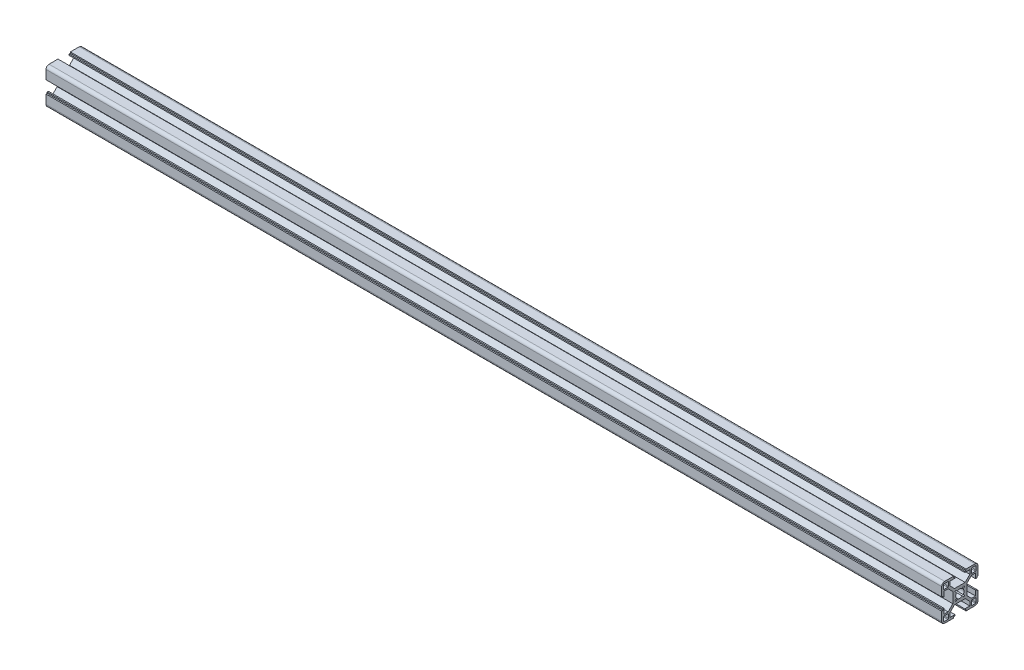
from build123d import *

# Parameters (mm, degrees)
EXTRUDE_1_DEPTH = 50
EXTRUDE_2_DEPTH = 740


with BuildPart() as part:
    # 草图1 → 凸台-拉伸1 (new body)
    with BuildSketch(Plane(origin=(0, 0, 0), x_dir=(0, 0, -1), z_dir=(1, 0, 0))):
        with BuildLine():
            Line((-5.14957074, -13.70467014), (-4.14957074, -13.70467014))
            Line((-4.14957074, -13.70467014), (-4.14957074, -12.70467014))
            Line((-4.14957074, -12.70467014), (-8.29957074, -12.70467014))
            Line((-8.29957074, -12.70467014), (-8.29957074, -9.3688837))
            Line((-8.29957074, -9.3688837), (-4.43535718, -5.50467014))
            Line((-4.43535718, -5.50467014), (4.3362157, -5.50467014))
            Line((4.3362157, -5.50467014), (8.20042926, -9.3688837))
            Line((8.20042926, -9.3688837), (8.20042926, -12.70467014))
            Line((8.20042926, -12.70467014), (4.05042926, -12.70467014))
            Line((4.05042926, -12.70467014), (4.05042926, -13.70467014))
            Line((4.05042926, -13.70467014), (5.05042926, -13.70467014))
            Line((5.05042926, -13.70467014), (5.05042926, -14.70467014))
            Line((5.05042926, -14.70467014), (12.45042926, -14.70467014))
            ThreePointArc((12.45042926, -14.70467014), (14.218196213, -13.972437093), (14.95042926, -12.20467014))
            Line((14.95042926, -12.20467014), (14.95042926, -4.80467014))
            Line((14.95042926, -4.80467014), (13.95042926, -4.80467014))
            Line((13.95042926, -4.80467014), (13.95042926, -3.80467014))
            Line((13.95042926, -3.80467014), (12.95042926, -3.80467014))
            Line((12.95042926, -3.80467014), (12.95042926, -7.95467014))
            Line((12.95042926, -7.95467014), (9.61464282, -7.95467014))
            Line((9.61464282, -7.95467014), (5.75042926, -4.09045658))
            Line((5.75042926, -4.09045658), (5.75042926, 4.6811163))
            Line((5.75042926, 4.6811163), (9.61464282, 8.54532986))
            Line((9.61464282, 8.54532986), (12.95042926, 8.54532986))
            Line((12.95042926, 8.54532986), (12.95042926, 4.39532986))
            Line((12.95042926, 4.39532986), (13.95042926, 4.39532986))
            Line((13.95042926, 4.39532986), (13.95042926, 5.39532986))
            Line((13.95042926, 5.39532986), (14.95042926, 5.39532986))
            Line((14.95042926, 5.39532986), (14.95042926, 12.79532986))
            ThreePointArc((14.95042926, 12.79532986), (14.218196213, 14.563096813), (12.45042926, 15.29532986))
            Line((12.45042926, 15.29532986), (5.05042926, 15.29532986))
            Line((5.05042926, 15.29532986), (5.05042926, 14.29532986))
            Line((5.05042926, 14.29532986), (4.05042926, 14.29532986))
            Line((4.05042926, 14.29532986), (4.05042926, 13.29532986))
            Line((4.05042926, 13.29532986), (8.20042926, 13.29532986))
            Line((8.20042926, 13.29532986), (8.20042926, 9.95954342))
            Line((8.20042926, 9.95954342), (4.3362157, 6.09532986))
            Line((4.3362157, 6.09532986), (-4.43535718, 6.09532986))
            Line((-4.43535718, 6.09532986), (-8.29957074, 9.95954342))
            Line((-8.29957074, 9.95954342), (-8.29957074, 13.29532986))
            Line((-8.29957074, 13.29532986), (-4.14957074, 13.29532986))
            Line((-4.14957074, 13.29532986), (-4.14957074, 14.29532986))
            Line((-4.14957074, 14.29532986), (-5.14957074, 14.29532986))
            Line((-5.14957074, 14.29532986), (-5.14957074, 15.29532986))
            Line((-5.14957074, 15.29532986), (-12.54957074, 15.29532986))
            ThreePointArc((-12.54957074, 15.29532986), (-14.317337693, 14.563096813), (-15.04957074, 12.79532986))
            Line((-15.04957074, 12.79532986), (-15.04957074, 5.39532986))
            Line((-15.04957074, 5.39532986), (-14.04957074, 5.39532986))
            Line((-14.04957074, 5.39532986), (-14.04957074, 4.39532986))
            Line((-14.04957074, 4.39532986), (-13.04957074, 4.39532986))
            Line((-13.04957074, 4.39532986), (-13.04957074, 8.54532986))
            Line((-13.04957074, 8.54532986), (-9.7137843, 8.54532986))
            Line((-9.7137843, 8.54532986), (-5.84957074, 4.6811163))
            Line((-5.84957074, 4.6811163), (-5.84957074, -4.09045658))
            Line((-5.84957074, -4.09045658), (-9.7137843, -7.95467014))
            Line((-9.7137843, -7.95467014), (-13.04957074, -7.95467014))
            Line((-13.04957074, -7.95467014), (-13.04957074, -3.80467014))
            Line((-13.04957074, -3.80467014), (-14.04957074, -3.80467014))
            Line((-14.04957074, -3.80467014), (-14.04957074, -4.80467014))
            Line((-14.04957074, -4.80467014), (-15.04957074, -4.80467014))
            Line((-15.04957074, -4.80467014), (-15.04957074, -12.20467014))
            ThreePointArc((-15.04957074, -12.20467014), (-14.317337693, -13.972437093), (-12.54957074, -14.70467014))
            Line((-12.54957074, -14.70467014), (-5.14957074, -14.70467014))
            Line((-5.14957074, -14.70467014), (-5.14957074, -13.70467014))
        make_face()
        with BuildLine():
            Line((-10.04957074, 9.79532986), (-13.04957074, 9.79532986))
            ThreePointArc((-13.04957074, 9.79532986), (-13.403124131, 9.941776469), (-13.54957074, 10.29532986))
            Line((-13.54957074, 10.29532986), (-13.54957074, 13.29532986))
            ThreePointArc((-13.54957074, 13.29532986), (-13.403124131, 13.648883251), (-13.04957074, 13.79532986))
            Line((-13.04957074, 13.79532986), (-10.04957074, 13.79532986))
            ThreePointArc((-10.04957074, 13.79532986), (-9.696017349, 13.648883251), (-9.54957074, 13.29532986))
            Line((-9.54957074, 13.29532986), (-9.54957074, 10.29532986))
            ThreePointArc((-9.54957074, 10.29532986), (-9.696017349, 9.941776469), (-10.04957074, 9.79532986))
        make_face(mode=Mode.SUBTRACT)
        with BuildLine():
            Line((-10.04957074, -13.20467014), (-13.04957074, -13.20467014))
            ThreePointArc((-13.04957074, -13.20467014), (-13.403124131, -13.058223531), (-13.54957074, -12.70467014))
            Line((-13.54957074, -12.70467014), (-13.54957074, -9.70467014))
            ThreePointArc((-13.54957074, -9.70467014), (-13.403124131, -9.351116749), (-13.04957074, -9.20467014))
            Line((-13.04957074, -9.20467014), (-10.04957074, -9.20467014))
            ThreePointArc((-10.04957074, -9.20467014), (-9.696017349, -9.351116749), (-9.54957074, -9.70467014))
            Line((-9.54957074, -9.70467014), (-9.54957074, -12.70467014))
            ThreePointArc((-9.54957074, -12.70467014), (-9.696017349, -13.058223531), (-10.04957074, -13.20467014))
        make_face(mode=Mode.SUBTRACT)
        with BuildLine():
            Line((12.95042926, 9.79532986), (9.95042926, 9.79532986))
            ThreePointArc((9.95042926, 9.79532986), (9.596875869, 9.941776469), (9.45042926, 10.29532986))
            Line((9.45042926, 10.29532986), (9.45042926, 13.29532986))
            ThreePointArc((9.45042926, 13.29532986), (9.596875869, 13.648883251), (9.95042926, 13.79532986))
            Line((9.95042926, 13.79532986), (12.95042926, 13.79532986))
            ThreePointArc((12.95042926, 13.79532986), (13.303982651, 13.648883251), (13.45042926, 13.29532986))
            Line((13.45042926, 13.29532986), (13.45042926, 10.29532986))
            ThreePointArc((13.45042926, 10.29532986), (13.303982651, 9.941776469), (12.95042926, 9.79532986))
        make_face(mode=Mode.SUBTRACT)
        with BuildLine():
            Line((13.45042926, -9.70467014), (13.45042926, -12.70467014))
            ThreePointArc((13.45042926, -12.70467014), (13.303982651, -13.058223531), (12.95042926, -13.20467014))
            Line((12.95042926, -13.20467014), (9.95042926, -13.20467014))
            ThreePointArc((9.95042926, -13.20467014), (9.596875869, -13.058223531), (9.45042926, -12.70467014))
            Line((9.45042926, -12.70467014), (9.45042926, -9.70467014))
            ThreePointArc((9.45042926, -9.70467014), (9.596875869, -9.351116749), (9.95042926, -9.20467014))
            Line((9.95042926, -9.20467014), (12.95042926, -9.20467014))
            ThreePointArc((12.95042926, -9.20467014), (13.303982651, -9.351116749), (13.45042926, -9.70467014))
        make_face(mode=Mode.SUBTRACT)
        with BuildLine():
            Line((-4.07998961, 3.61864195), (-3.37288283, 4.32574873))
            Line((-3.37288283, 4.32574873), (-2.07404174, 3.02690764))
            ThreePointArc((-2.07404174, 3.02690764), (-0.04957074, 3.69532986), (1.97490026, 3.02690764))
            Line((1.97490026, 3.02690764), (3.27374135, 4.32574873))
            Line((3.27374135, 4.32574873), (3.98084813, 3.61864195))
            Line((3.98084813, 3.61864195), (2.68200704, 2.31980086))
            ThreePointArc((2.68200704, 2.31980086), (3.35042926, 0.29532986), (2.68200704, -1.72914114))
            Line((2.68200704, -1.72914114), (3.98084813, -3.02798223))
            Line((3.98084813, -3.02798223), (3.27374135, -3.73508901))
            Line((3.27374135, -3.73508901), (1.97490026, -2.43624792))
            ThreePointArc((1.97490026, -2.43624792), (-0.04957074, -3.10467014), (-2.07404174, -2.43624792))
            Line((-2.07404174, -2.43624792), (-3.37288283, -3.73508901))
            Line((-3.37288283, -3.73508901), (-4.07998961, -3.02798223))
            Line((-4.07998961, -3.02798223), (-2.78114852, -1.72914114))
            ThreePointArc((-2.78114852, -1.72914114), (-3.44957074, 0.29532986), (-2.78114852, 2.31980086))
            Line((-2.78114852, 2.31980086), (-4.07998961, 3.61864195))
        make_face(mode=Mode.SUBTRACT)
    extrude(amount=-EXTRUDE_1_DEPTH)

    # 草图2 → 凸台-拉伸2 (add)
    with BuildSketch(Plane(origin=(0, 0, 0), x_dir=(0, 0, -1), z_dir=(1, 0, 0))):
        with BuildLine():
            Line((-15.04957074, -4.80467014), (-15.04957074, -12.20467014))
            ThreePointArc((-15.04957074, -12.20467014), (-14.317337693, -13.972437093), (-12.54957074, -14.70467014))
            Line((-12.54957074, -14.70467014), (-5.14957074, -14.70467014))
            Line((-5.14957074, -14.70467014), (-5.14957074, -13.70467014))
            Line((-5.14957074, -13.70467014), (-4.14957074, -13.70467014))
            Line((-4.14957074, -13.70467014), (-4.14957074, -12.70467014))
            Line((-4.14957074, -12.70467014), (-8.29957074, -12.70467014))
            Line((-8.29957074, -12.70467014), (-8.29957074, -9.3688837))
            Line((-8.29957074, -9.3688837), (-4.43535718, -5.50467014))
            Line((-4.43535718, -5.50467014), (4.3362157, -5.50467014))
            Line((4.3362157, -5.50467014), (8.20042926, -9.3688837))
            Line((8.20042926, -9.3688837), (8.20042926, -12.70467014))
            Line((8.20042926, -12.70467014), (4.05042926, -12.70467014))
            Line((4.05042926, -12.70467014), (4.05042926, -13.70467014))
            Line((4.05042926, -13.70467014), (5.05042926, -13.70467014))
            Line((5.05042926, -13.70467014), (5.05042926, -14.70467014))
            Line((5.05042926, -14.70467014), (12.45042926, -14.70467014))
            ThreePointArc((12.45042926, -14.70467014), (14.218196213, -13.972437093), (14.95042926, -12.20467014))
            Line((14.95042926, -12.20467014), (14.95042926, -4.80467014))
            Line((14.95042926, -4.80467014), (13.95042926, -4.80467014))
            Line((13.95042926, -4.80467014), (13.95042926, -3.80467014))
            Line((13.95042926, -3.80467014), (12.95042926, -3.80467014))
            Line((12.95042926, -3.80467014), (12.95042926, -7.95467014))
            Line((12.95042926, -7.95467014), (9.61464282, -7.95467014))
            Line((9.61464282, -7.95467014), (5.75042926, -4.09045658))
            Line((5.75042926, -4.09045658), (5.75042926, 4.6811163))
            Line((5.75042926, 4.6811163), (9.61464282, 8.54532986))
            Line((9.61464282, 8.54532986), (12.95042926, 8.54532986))
            Line((12.95042926, 8.54532986), (12.95042926, 4.39532986))
            Line((12.95042926, 4.39532986), (13.95042926, 4.39532986))
            Line((13.95042926, 4.39532986), (13.95042926, 5.39532986))
            Line((13.95042926, 5.39532986), (14.95042926, 5.39532986))
            Line((14.95042926, 5.39532986), (14.95042926, 12.79532986))
            ThreePointArc((14.95042926, 12.79532986), (14.218196213, 14.563096813), (12.45042926, 15.29532986))
            Line((12.45042926, 15.29532986), (5.05042926, 15.29532986))
            Line((5.05042926, 15.29532986), (5.05042926, 14.29532986))
            Line((5.05042926, 14.29532986), (4.05042926, 14.29532986))
            Line((4.05042926, 14.29532986), (4.05042926, 13.29532986))
            Line((4.05042926, 13.29532986), (8.20042926, 13.29532986))
            Line((8.20042926, 13.29532986), (8.20042926, 9.95954342))
            Line((8.20042926, 9.95954342), (4.3362157, 6.09532986))
            Line((4.3362157, 6.09532986), (-4.43535718, 6.09532986))
            Line((-4.43535718, 6.09532986), (-8.29957074, 9.95954342))
            Line((-8.29957074, 9.95954342), (-8.29957074, 13.29532986))
            Line((-8.29957074, 13.29532986), (-4.14957074, 13.29532986))
            Line((-4.14957074, 13.29532986), (-4.14957074, 14.29532986))
            Line((-4.14957074, 14.29532986), (-5.14957074, 14.29532986))
            Line((-5.14957074, 14.29532986), (-5.14957074, 15.29532986))
            Line((-5.14957074, 15.29532986), (-12.54957074, 15.29532986))
            ThreePointArc((-12.54957074, 15.29532986), (-14.317337693, 14.563096813), (-15.04957074, 12.79532986))
            Line((-15.04957074, 12.79532986), (-15.04957074, 5.39532986))
            Line((-15.04957074, 5.39532986), (-14.04957074, 5.39532986))
            Line((-14.04957074, 5.39532986), (-14.04957074, 4.39532986))
            Line((-14.04957074, 4.39532986), (-13.04957074, 4.39532986))
            Line((-13.04957074, 4.39532986), (-13.04957074, 8.54532986))
            Line((-13.04957074, 8.54532986), (-9.7137843, 8.54532986))
            Line((-9.7137843, 8.54532986), (-5.84957074, 4.6811163))
            Line((-5.84957074, 4.6811163), (-5.84957074, -4.09045658))
            Line((-5.84957074, -4.09045658), (-9.7137843, -7.95467014))
            Line((-9.7137843, -7.95467014), (-13.04957074, -7.95467014))
            Line((-13.04957074, -7.95467014), (-13.04957074, -3.80467014))
            Line((-13.04957074, -3.80467014), (-14.04957074, -3.80467014))
            Line((-14.04957074, -3.80467014), (-14.04957074, -4.80467014))
            Line((-14.04957074, -4.80467014), (-15.04957074, -4.80467014))
        make_face()
        with BuildLine():
            Line((-13.04957074, 9.79532986), (-10.04957074, 9.79532986))
            ThreePointArc((-10.04957074, 9.79532986), (-9.696017349, 9.941776469), (-9.54957074, 10.29532986))
            Line((-9.54957074, 10.29532986), (-9.54957074, 13.29532986))
            ThreePointArc((-9.54957074, 13.29532986), (-9.696017349, 13.648883251), (-10.04957074, 13.79532986))
            Line((-10.04957074, 13.79532986), (-13.04957074, 13.79532986))
            ThreePointArc((-13.04957074, 13.79532986), (-13.403124131, 13.648883251), (-13.54957074, 13.29532986))
            Line((-13.54957074, 13.29532986), (-13.54957074, 10.29532986))
            ThreePointArc((-13.54957074, 10.29532986), (-13.403124131, 9.941776469), (-13.04957074, 9.79532986))
        make_face(mode=Mode.SUBTRACT)
        with BuildLine():
            Line((-13.04957074, -13.20467014), (-10.04957074, -13.20467014))
            ThreePointArc((-10.04957074, -13.20467014), (-9.696017349, -13.058223531), (-9.54957074, -12.70467014))
            Line((-9.54957074, -12.70467014), (-9.54957074, -9.70467014))
            ThreePointArc((-9.54957074, -9.70467014), (-9.696017349, -9.351116749), (-10.04957074, -9.20467014))
            Line((-10.04957074, -9.20467014), (-13.04957074, -9.20467014))
            ThreePointArc((-13.04957074, -9.20467014), (-13.403124131, -9.351116749), (-13.54957074, -9.70467014))
            Line((-13.54957074, -9.70467014), (-13.54957074, -12.70467014))
            ThreePointArc((-13.54957074, -12.70467014), (-13.403124131, -13.058223531), (-13.04957074, -13.20467014))
        make_face(mode=Mode.SUBTRACT)
        with BuildLine():
            Line((9.45042926, 13.29532986), (9.45042926, 10.29532986))
            ThreePointArc((9.45042926, 10.29532986), (9.596875869, 9.941776469), (9.95042926, 9.79532986))
            Line((9.95042926, 9.79532986), (12.95042926, 9.79532986))
            ThreePointArc((12.95042926, 9.79532986), (13.303982651, 9.941776469), (13.45042926, 10.29532986))
            Line((13.45042926, 10.29532986), (13.45042926, 13.29532986))
            ThreePointArc((13.45042926, 13.29532986), (13.303982651, 13.648883251), (12.95042926, 13.79532986))
            Line((12.95042926, 13.79532986), (9.95042926, 13.79532986))
            ThreePointArc((9.95042926, 13.79532986), (9.596875869, 13.648883251), (9.45042926, 13.29532986))
        make_face(mode=Mode.SUBTRACT)
        with BuildLine():
            Line((9.45042926, -9.70467014), (9.45042926, -12.70467014))
            ThreePointArc((9.45042926, -12.70467014), (9.596875869, -13.058223531), (9.95042926, -13.20467014))
            Line((9.95042926, -13.20467014), (12.95042926, -13.20467014))
            ThreePointArc((12.95042926, -13.20467014), (13.303982651, -13.058223531), (13.45042926, -12.70467014))
            Line((13.45042926, -12.70467014), (13.45042926, -9.70467014))
            ThreePointArc((13.45042926, -9.70467014), (13.303982651, -9.351116749), (12.95042926, -9.20467014))
            Line((12.95042926, -9.20467014), (9.95042926, -9.20467014))
            ThreePointArc((9.95042926, -9.20467014), (9.596875869, -9.351116749), (9.45042926, -9.70467014))
        make_face(mode=Mode.SUBTRACT)
        with BuildLine():
            Line((-3.37288283, -3.73508901), (-2.07404174, -2.43624792))
            ThreePointArc((-2.07404174, -2.43624792), (-0.04957074, -3.10467014), (1.97490026, -2.43624792))
            Line((1.97490026, -2.43624792), (3.27374135, -3.73508901))
            Line((3.27374135, -3.73508901), (3.98084813, -3.02798223))
            Line((3.98084813, -3.02798223), (2.68200704, -1.72914114))
            ThreePointArc((2.68200704, -1.72914114), (3.35042926, 0.29532986), (2.68200704, 2.31980086))
            Line((2.68200704, 2.31980086), (3.98084813, 3.61864195))
            Line((3.98084813, 3.61864195), (3.27374135, 4.32574873))
            Line((3.27374135, 4.32574873), (1.97490026, 3.02690764))
            ThreePointArc((1.97490026, 3.02690764), (-0.04957074, 3.69532986), (-2.07404174, 3.02690764))
            Line((-2.07404174, 3.02690764), (-3.37288283, 4.32574873))
            Line((-3.37288283, 4.32574873), (-4.07998961, 3.61864195))
            Line((-4.07998961, 3.61864195), (-2.78114852, 2.31980086))
            ThreePointArc((-2.78114852, 2.31980086), (-3.44957074, 0.29532986), (-2.78114852, -1.72914114))
            Line((-2.78114852, -1.72914114), (-4.07998961, -3.02798223))
            Line((-4.07998961, -3.02798223), (-3.37288283, -3.73508901))
        make_face(mode=Mode.SUBTRACT)
    extrude(amount=-EXTRUDE_2_DEPTH)


solid = part.part
